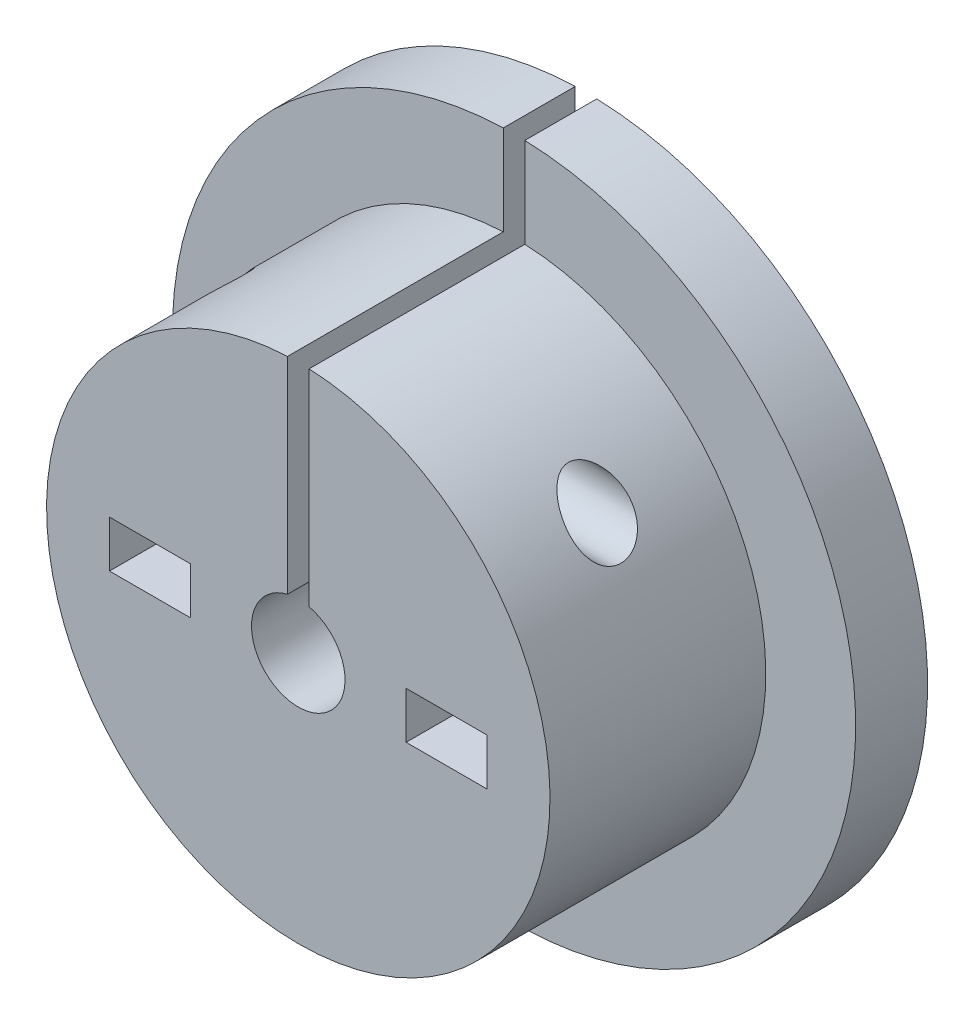
from build123d import *

# Parameters (mm, degrees)
SKETCH_1_R                                       = 19
HORN_FLANGE_D38_DEPTH                            = 4
SKETCH_2_R                                       = 14
SHAFT_CLAMP_HUB_DEPTH                            = 16
SHAFT_D5P2_DEPTH                                 = 32.272991542
SHAFT_D5P2_DEPTH_BACK                            = 32.272991542
SKETCH_3_R                                       = 2.6
CLAMP_SPLIT_DEPTH                                = 32.272991542
CLAMP_SPLIT_DEPTH_BACK                           = 32.272991542
SKETCH_4_W                                       = 1.2
SKETCH_4_H                                       = 17.8
HORN_TWO_ADJUSTMENT_SLOTS_VERIFY_HORN_DEPTH      = 32.272991542
HORN_TWO_ADJUSTMENT_SLOTS_VERIFY_HORN_DEPTH_BACK = 32.272991542
SKETCH_5_W                                       = 4.5
SKETCH_5_H                                       = 2.6
COUPLER_CLAMP_M3_DEPTH                           = 32.272991542
COUPLER_CLAMP_M3_DEPTH_BACK                      = 32.272991542
SKETCH_6_R                                       = 1.7


with BuildPart() as part:
    # 草图1 → Horn_flange_D38 (new body)
    with BuildSketch(Plane.XY):
        Circle(SKETCH_1_R)
    extrude(amount=HORN_FLANGE_D38_DEPTH)

    # 草图2 → Shaft_clamp_hub (add)
    with BuildSketch(Plane.XY):
        Circle(SKETCH_2_R)
    extrude(amount=SHAFT_CLAMP_HUB_DEPTH)

    # 草图3 → Shaft_D5p2 (cut, two sides: drawn at the far end of the back side and taken through both)
    with BuildSketch(Plane.XY.offset(-SHAFT_D5P2_DEPTH_BACK)):
        Circle(SKETCH_3_R)
    extrude(amount=SHAFT_D5P2_DEPTH + SHAFT_D5P2_DEPTH_BACK, mode=Mode.SUBTRACT)

    # 草图4 → Clamp_split (cut, two sides: drawn at the far end of the back side and taken through both)
    with BuildSketch(Plane.XY.offset(-CLAMP_SPLIT_DEPTH_BACK)):
        with Locations((0, 11.1)):
            Rectangle(SKETCH_4_W, SKETCH_4_H)
    extrude(amount=CLAMP_SPLIT_DEPTH + CLAMP_SPLIT_DEPTH_BACK, mode=Mode.SUBTRACT)

    # 草图5 → Horn_two_adjustment_slots_VERIFY_HORN (cut, two sides: drawn at the far end of the back side and taken through both)
    with BuildSketch(Plane.XY.offset(-HORN_TWO_ADJUSTMENT_SLOTS_VERIFY_HORN_DEPTH_BACK)):
        with Locations((-8.25, 0)):
            Rectangle(SKETCH_5_W, SKETCH_5_H)
        with Locations((8.25, 0)):
            Rectangle(SKETCH_5_W, SKETCH_5_H)
    extrude(amount=HORN_TWO_ADJUSTMENT_SLOTS_VERIFY_HORN_DEPTH + HORN_TWO_ADJUSTMENT_SLOTS_VERIFY_HORN_DEPTH_BACK, mode=Mode.SUBTRACT)

    # 草图6 → Coupler_clamp_M3 (cut, two sides: drawn at the far end of the back side and taken through both)
    with BuildSketch(Plane(origin=(0, 0, 0), x_dir=(0, 0, -1), z_dir=(1, 0, 0)).offset(-COUPLER_CLAMP_M3_DEPTH_BACK)):
        with Locations((-10, 9)):
            Circle(SKETCH_6_R)
    extrude(amount=COUPLER_CLAMP_M3_DEPTH + COUPLER_CLAMP_M3_DEPTH_BACK, mode=Mode.SUBTRACT)


solid = part.part
